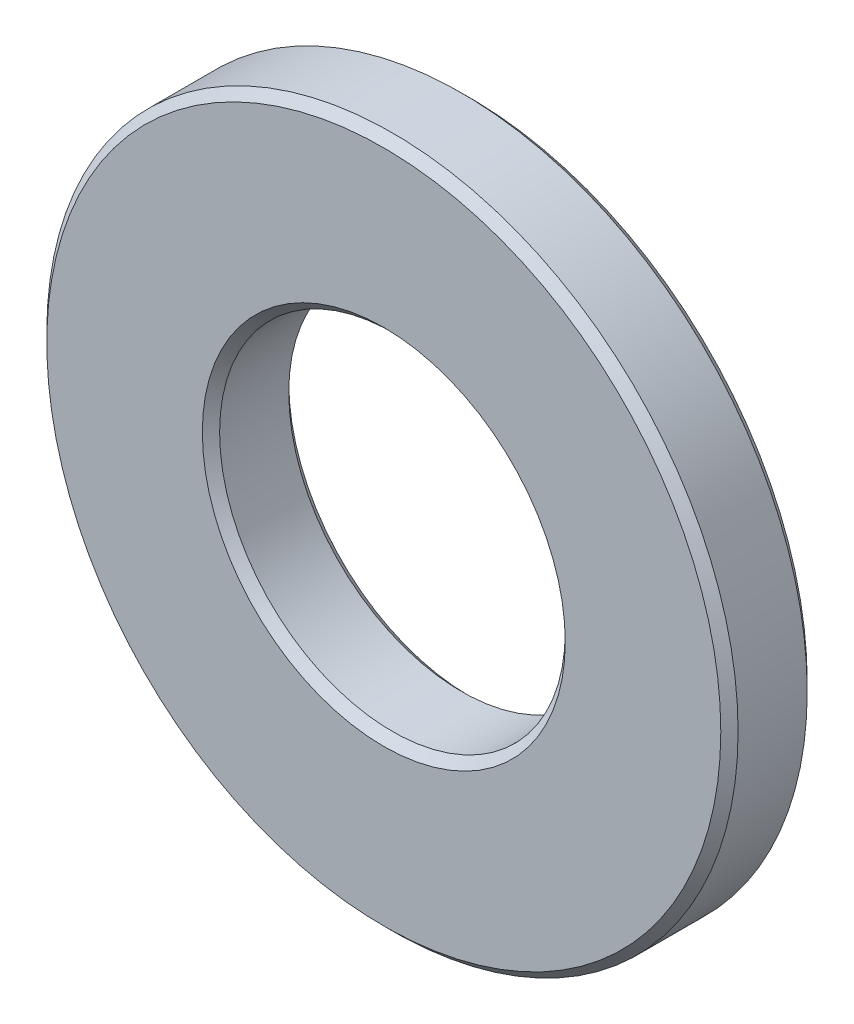
from build123d import *

# Parameters (mm, degrees)
SKETCH_1_R      = 4
SKETCH_1_R_2    = 2
EXTRUDE_1_DEPTH = 0.5
CHAMFER_1_SIZE  = 0.1


with BuildPart() as part:
    # 草图1 → 凸台-拉伸1 (new, symmetric)
    with BuildSketch(Plane.XY):
        Circle(SKETCH_1_R)
        Circle(SKETCH_1_R_2, mode=Mode.SUBTRACT)
    extrude(amount=EXTRUDE_1_DEPTH, both=True)

    # 倒角1
    chamfer_1_edges = [part.edges().sort_by_distance(p)[0] for p in [
        (-4, 0, -0.5),
        (-4, 0, 0.5),
        (-2, 0, -0.5),
        (-2, 0, 0.5),
    ]]
    chamfer(chamfer_1_edges, length=CHAMFER_1_SIZE)


solid = part.part
